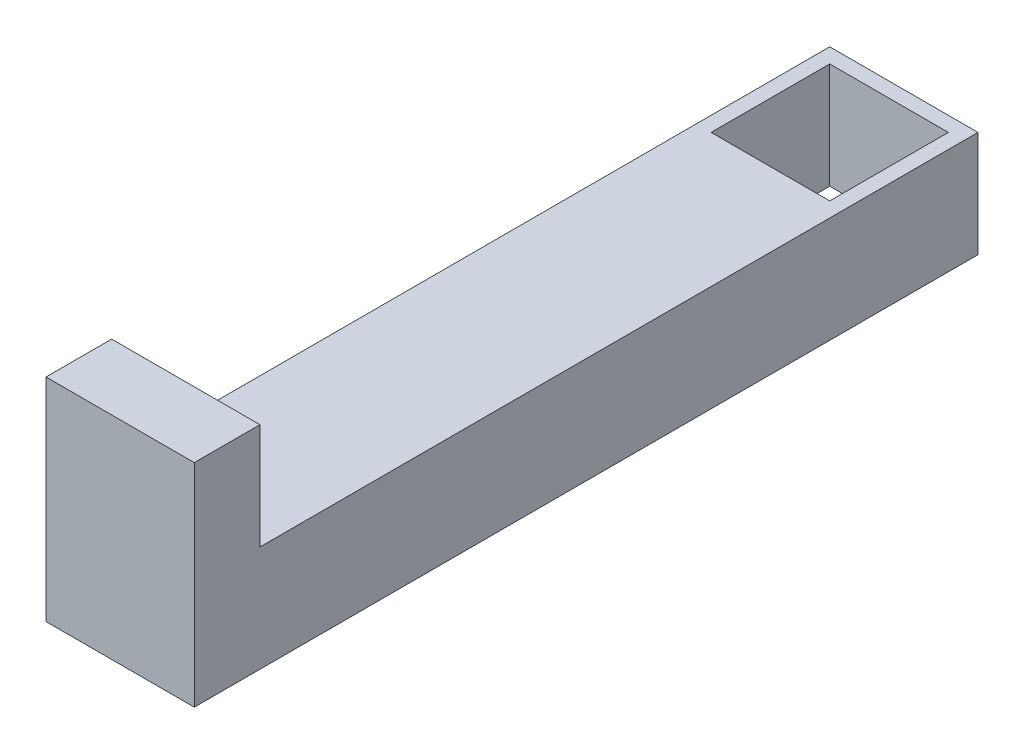
from build123d import *

# Parameters (mm, degrees)
SKETCH1_W           = 3.5
SKETCH1_H           = 18.5
SKETCH1_W_2         = 2.8
SKETCH1_H_2         = 2.8
BOSS_EXTRUDE1_DEPTH = 2.5
SKETCH4_W           = 3.5
SKETCH4_H           = 1.549747226
BOSS_EXTRUDE2_DEPTH = 2.5


with BuildPart() as part:
    # Sketch1 → Boss-Extrude1 (new body)
    with BuildSketch(Plane(origin=(0, 0, 0), x_dir=(1, 0, 0), z_dir=(0, 1, 0))):
        with Locations((0, -7.5)):
            Rectangle(SKETCH1_W, SKETCH1_H)
        Rectangle(SKETCH1_W_2, SKETCH1_H_2, mode=Mode.SUBTRACT)
    extrude(amount=BOSS_EXTRUDE1_DEPTH)

    # Sketch4 → Boss-Extrude2 (add)
    with BuildSketch(Plane(origin=(0, 2.5, 0), x_dir=(1, 0, 0), z_dir=(0, 1, 0))):
        with Locations((0, -15.975126387)):
            Rectangle(SKETCH4_W, SKETCH4_H)
    extrude(amount=BOSS_EXTRUDE2_DEPTH)


solid = part.part
